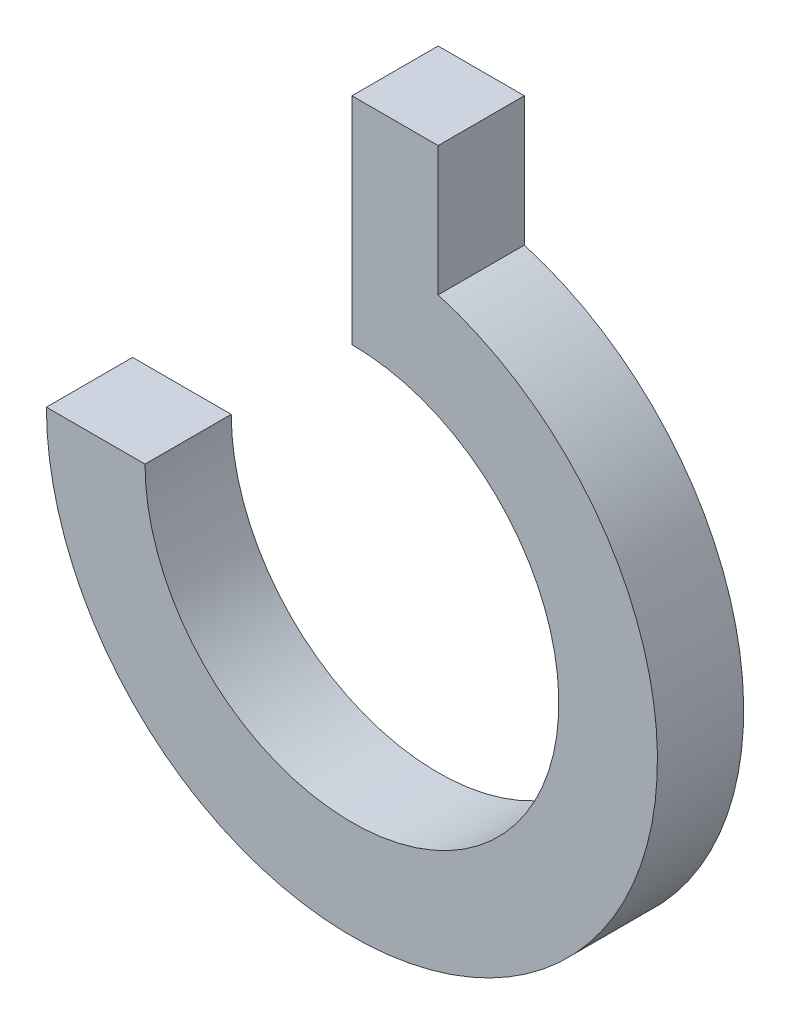
from build123d import *

# Parameters (mm, degrees)
BOSS_EXTRUDE1_DEPTH = 50


with BuildPart() as part:
    # Sketch1 → Boss-Extrude1 (new body)
    with BuildSketch(Plane.XY):
        with BuildLine():
            Line((0, 62.5), (0, -62.5))
            ThreePointArc((0, -62.5), (84.852813742, -267.352813742), (-120, -182.5))
            Line((-120, -182.5), (-177.200451467, -182.5))
            ThreePointArc((-177.200451467, -182.5), (106.160203058, -324.380270956), (50, -12.5))
            Line((50, -12.5), (50, 62.5))
            Line((50, 62.5), (0, 62.5))
        make_face()
    extrude(amount=BOSS_EXTRUDE1_DEPTH)


solid = part.part
